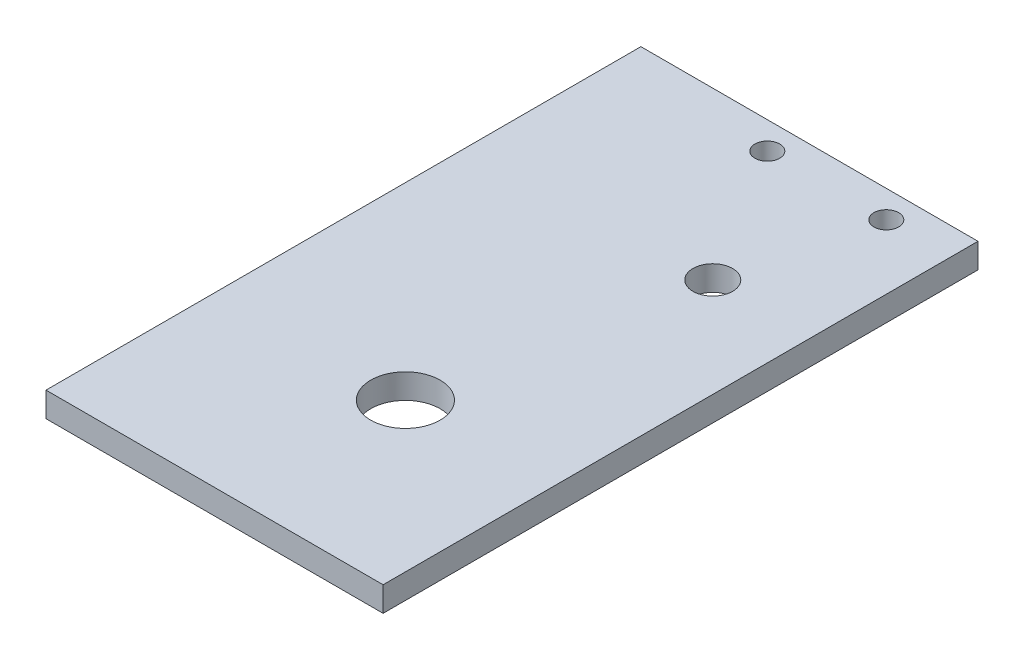
from build123d import *

# Parameters (mm, degrees)
BOSS_EXTRU_1_DEPTH      = 120
ESQUISSE2_W             = 45
ESQUISSE2_H             = 35
ENL_V_MAT_EXTRU_1_DEPTH = 10
ESQUISSE3_R             = 7
ENL_V_MAT_EXTRU_2_DEPTH = 10
ESQUISSE4_R             = 3
ENL_V_MAT_EXTRU_3_DEPTH = 142.311712183
TROU_TARAUD_M61_D       = 5
TROU_TARAUD_M61_DEPTH   = 15
TROU_TARAUD_M61_TIP     = 1.502151548
ESQUISSE7_W             = 30
ESQUISSE7_H             = 35
ENL_V_MAT_EXTRU_4_DEPTH = 10
ESQUISSE8_R             = 4
ENL_V_MAT_EXTRU_5_DEPTH = 20


with BuildPart() as part:
    # Esquisse1 → Boss.-Extru.1 (new body)
    with BuildSketch(Plane.XY):
        Polygon((0, 0), (0, -40), (-68, -40), (-68, -35), (-5, -35), (-5, 0), align=None)
    extrude(amount=BOSS_EXTRU_1_DEPTH)

    # Esquisse2 → Enlèv. mat.-Extru.1 (cut)
    with BuildSketch(Plane.ZY.offset(5)):
        with Locations((22.5, -17.5)):
            Rectangle(ESQUISSE2_W, ESQUISSE2_H)
        with Locations((97.5, -17.5)):
            Rectangle(ESQUISSE2_W, ESQUISSE2_H)
    extrude(amount=-ENL_V_MAT_EXTRU_1_DEPTH, mode=Mode.SUBTRACT)

    # Esquisse3 → Enlèv. mat.-Extru.2 (cut)
    with BuildSketch(Plane.XZ.offset(40)):
        with Locations((-30, 85.5)):
            Circle(ESQUISSE3_R)
    extrude(amount=-ENL_V_MAT_EXTRU_2_DEPTH, mode=Mode.SUBTRACT)

    # Esquisse4 → Enlèv. mat.-Extru.3 (cut, through all)
    with BuildSketch(Plane.ZY.offset(5)):
        with Locations((50, -5)):
            Circle(ESQUISSE4_R)
        with Locations((50, -25)):
            Circle(ESQUISSE4_R)
    extrude(amount=-ENL_V_MAT_EXTRU_3_DEPTH, mode=Mode.SUBTRACT)

    # Trou taraudé M61
    with Locations(Plane(origin=(-37, -40, 5.5), x_dir=(0, 0, -1), z_dir=(0, -1, 0))):
        with Locations((0, 0), (0, 24)):
            Hole(TROU_TARAUD_M61_D / 2, depth=TROU_TARAUD_M61_DEPTH)
            with Locations((0, 0, -(TROU_TARAUD_M61_DEPTH + TROU_TARAUD_M61_TIP / 2))):  # 118° drill point
                Cone(0, TROU_TARAUD_M61_D / 2, TROU_TARAUD_M61_TIP, mode=Mode.SUBTRACT)

    # Esquisse7 → Enlèv. mat.-Extru.4 (cut)
    with BuildSketch(Plane.ZY.offset(5)):
        with Locations((60, -17.5)):
            Rectangle(ESQUISSE7_W, ESQUISSE7_H)
    extrude(amount=-ENL_V_MAT_EXTRU_4_DEPTH, mode=Mode.SUBTRACT)

    # Esquisse8 → Enlèv. mat.-Extru.5 (cut)
    with BuildSketch(Plane(origin=(0, -35, 0), x_dir=(1, 0, 0), z_dir=(0, 1, 0))):
        with Locations(Location((-20, -33.5, 0), (0, 0, 270))):
            Circle(ESQUISSE8_R)
    extrude(amount=-ENL_V_MAT_EXTRU_5_DEPTH, mode=Mode.SUBTRACT)


solid = part.part
